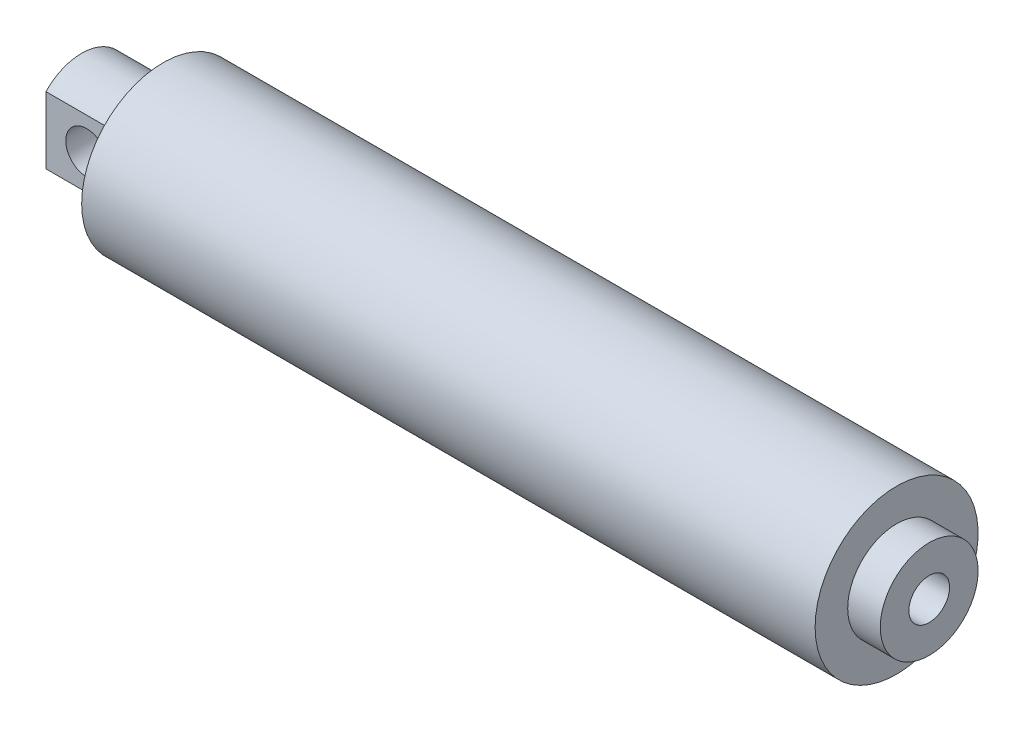
from build123d import *

# Parameters (mm, degrees)
SKETCH2_R          = 3.175
CUT_EXTRUDE1_DEPTH = 101.6
SKETCH3_W          = 2.54
SKETCH3_H          = 14.827996595
SKETCH3_H_2        = 14.256172231
CUT_EXTRUDE2_DEPTH = 12.7
SKETCH4_R          = 3.2639
CUT_EXTRUDE3_DEPTH = 124.410028215


with BuildPart() as part:
    # Sketch1 → Revolve2 (revolve)
    with BuildSketch(Plane.XY, mode=Mode.PRIVATE) as revolve2_sk:
        Polygon((-12.7, 20.32), (-12.7, 12.7), (119.38, 12.7), (119.38, 20.32), (114.3, 20.32), (114.3, 25.4), (0, 25.4), (0, 20.32), align=None)
    revolve(revolve2_sk.sketch.rotate(Axis((-12.7, 12.7, 0), (1, 0, 0)), 90), axis=Axis((-12.7, 12.7, 0), (1, 0, 0)))

    # Sketch2 → Cut-Extrude1 (cut)
    with BuildSketch(Plane(origin=(119.38, 0, 0), x_dir=(0, 0, -1), z_dir=(1, 0, 0))):
        with Locations((0, 12.7)):
            Circle(SKETCH2_R)
    extrude(amount=-CUT_EXTRUDE1_DEPTH, mode=Mode.SUBTRACT)

    # Sketch3 → Cut-Extrude2 (cut)
    with BuildSketch(Plane.ZY.offset(12.7)):
        with Locations((-6.82625, 12.906001702)):
            Rectangle(SKETCH3_W, SKETCH3_H)
        with Locations((6.82625, 13.191913884)):
            Rectangle(SKETCH3_W, SKETCH3_H_2)
    extrude(amount=-CUT_EXTRUDE2_DEPTH, mode=Mode.SUBTRACT)

    # Sketch4 → Cut-Extrude3 (cut, through all)
    with BuildSketch(Plane.XY.offset(5.55625)):
        with Locations((-6.35, 12.834641497)):
            Circle(SKETCH4_R)
    extrude(amount=-CUT_EXTRUDE3_DEPTH, mode=Mode.SUBTRACT)


solid = part.part
